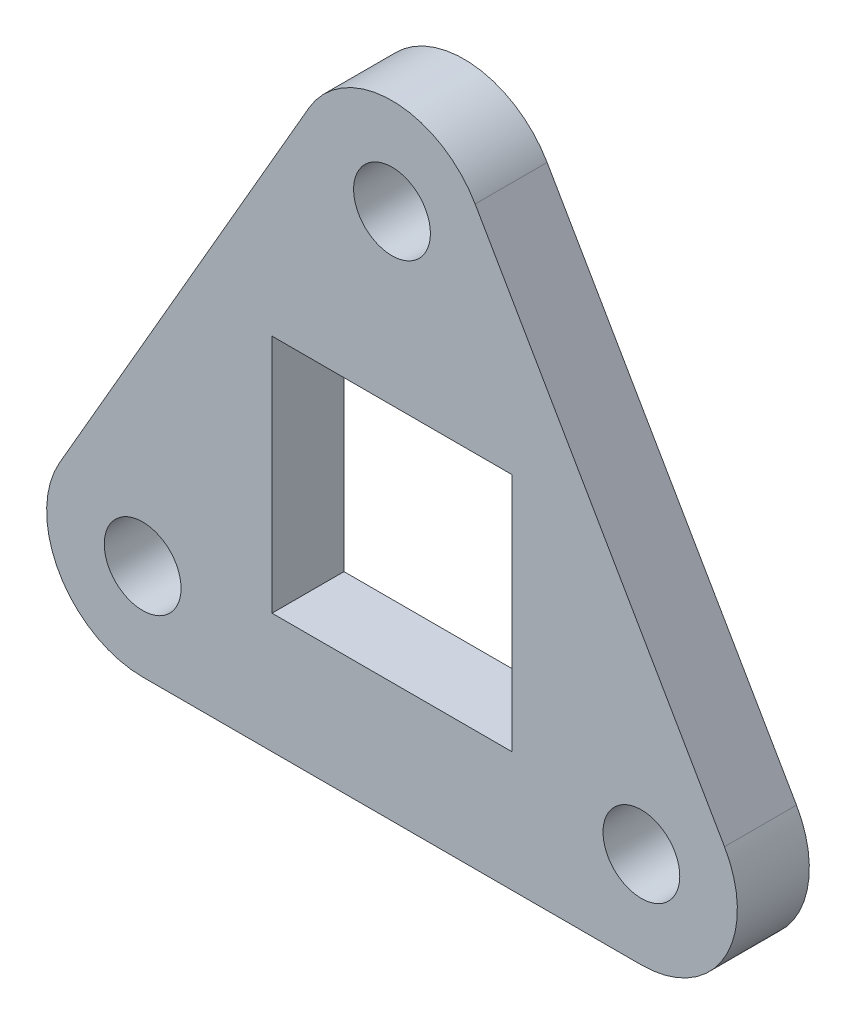
from build123d import *

# Parameters (mm, degrees)
SKETCH_1_R      = 1.6
SKETCH_1_W      = 10
SKETCH_1_H      = 10
EXTRUDE_1_DEPTH = 3


with BuildPart() as part:
    # ｽｹｯﾁ1 → ﾎﾞｽ - 押し出し1 (new body)
    with BuildSketch(Plane.XY):
        with BuildLine():
            Line((-13.856406461, -4), (-3.464101615, 14))
            ThreePointArc((-3.464101615, 14), (0, 16), (3.464101615, 14))
            Line((3.464101615, 14), (13.856406461, -4))
            ThreePointArc((13.856406461, -4), (13.856406461, -8), (10.392304845, -10))
            Line((10.392304845, -10), (-10.392304845, -10))
            ThreePointArc((-10.392304845, -10), (-13.856406461, -8), (-13.856406461, -4))
        make_face()
        with Locations((0, 12)):
            Circle(SKETCH_1_R, mode=Mode.SUBTRACT)
        with Locations((10.392304845, -6)):
            Circle(SKETCH_1_R, mode=Mode.SUBTRACT)
        with Locations((-10.392304845, -6)):
            Circle(SKETCH_1_R, mode=Mode.SUBTRACT)
        Rectangle(SKETCH_1_W, SKETCH_1_H, mode=Mode.SUBTRACT)
    extrude(amount=EXTRUDE_1_DEPTH)


solid = part.part
